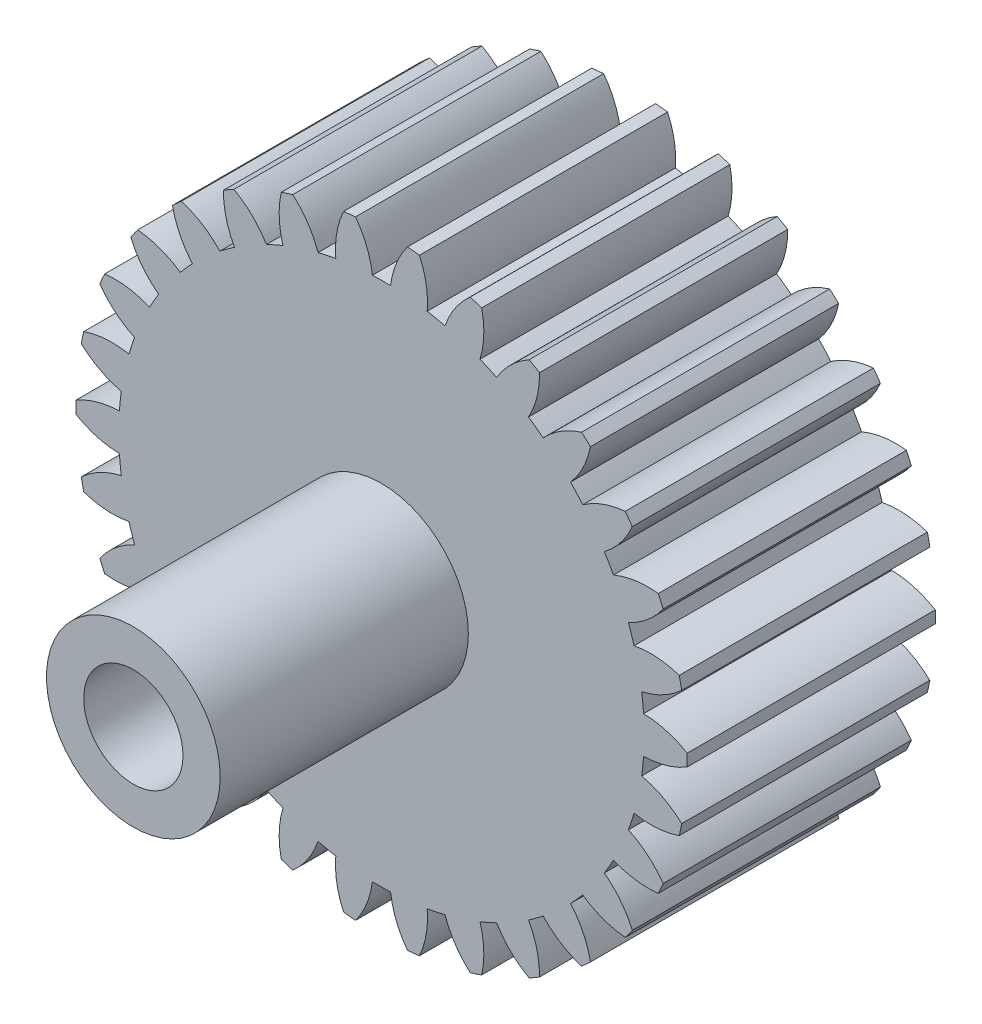
from build123d import *
from build123d.topology import SkipClean

# Parameters (mm, degrees)
SKETCH_1_R               = 12.32
EXTRUDE_1_DEPTH          = 5
PATTERN_CIRCULAR_1_COUNT = 30
SKETCH_6_R               = 3.5
EXTRUDE_2_DEPTH          = 10
SKETCH_7_R               = 2
CUT_EXTRUDE_1_DEPTH      = 3
CUT_EXTRUDE_2_DEPTH      = 25.320150441
CUT_EXTRUDE_2_DEPTH_BACK = 7


with BuildPart() as part:
    # Эскиз1 → Бобышка-Вытянуть1 (new, symmetric)
    with BuildSketch(Plane.XY):
        Circle(SKETCH_1_R)
    extrude(amount=EXTRUDE_1_DEPTH, both=True)

    # Эскиз5 for Вырез-По сечениям1 → Вырез-По сечениям1 section 0
    with BuildSketch(Plane.XY.offset(-5)):
        with BuildLine():
            # circular arc as an exact rational Bezier (weights 1, cos(half-angle), 1)
            Bezier((-1.458691761, 12.736742847), (-0.522105639, 11.856767026), (-0.365824723, 10.581178031), weights=[1, 0.940287899, 1])
            Bezier((-0.365824723, 10.581178031), (0, 10.593825746), (0.365824723, 10.581178031), weights=[1, 0.999402884, 1])
            Bezier((0.365824723, 10.581178031), (0.522105639, 11.856767026), (1.458691761, 12.736742847), weights=[1, 0.940287899, 1])
            Bezier((1.458691761, 12.736742847), (0, 12.903801386), (-1.458691761, 12.736742847), weights=[1, 0.993505682, 1])
        make_face()
    # Эскиз2 for Вырез-По сечениям1 → Вырез-По сечениям1 section 1
    with BuildSketch(Plane.XY.offset(5)):
        with BuildLine():
            Bezier((-1.458691761, 12.736742847), (-0.522105639, 11.856767026), (-0.365824723, 10.581178031), weights=[1, 0.940287899, 1])
            Bezier((-0.365824723, 10.581178031), (0, 10.593825746), (0.365824723, 10.581178031), weights=[1, 0.999402884, 1])
            Bezier((0.365824723, 10.581178031), (0.522105639, 11.856767026), (1.458691761, 12.736742847), weights=[1, 0.940287899, 1])
            Bezier((1.458691761, 12.736742847), (0, 12.903801386), (-1.458691761, 12.736742847), weights=[1, 0.993505682, 1])
        make_face()
    loft_1 = loft(mode=Mode.SUBTRACT)

    # Круговой массив1: Вырез-По сечениям1 ×30 about axis
    pattern_circular_1_axis = Axis((0, 0, 0), (0, 0, 1))
    for i in range(1, PATTERN_CIRCULAR_1_COUNT):
        add(loft_1.rotate(pattern_circular_1_axis, i * 360 / PATTERN_CIRCULAR_1_COUNT), mode=Mode.SUBTRACT)

    # Эскиз6 → Бобышка-Вытянуть2 (add)
    with BuildSketch(Plane.XY.offset(5)):
        Circle(SKETCH_6_R)
    extrude(amount=EXTRUDE_2_DEPTH)

    # Эскиз7 → Вырез-Вытянуть1 (cut)
    with BuildSketch(Plane.XY.offset(15)):
        Circle(SKETCH_7_R)
    extrude(amount=-CUT_EXTRUDE_1_DEPTH, mode=Mode.SUBTRACT)

    # Эскиз8 → Вырез-Вытянуть2 (cut, two sides: drawn at the far end of the back side and taken through both)
    with SkipClean():  # the faces are left unmerged after this step: merging them gives an invalid solid
        with BuildSketch(Plane.XY.offset(12).offset(-CUT_EXTRUDE_2_DEPTH_BACK)):
            with BuildLine():
                Line((1.263922466, 1.55), (-1.263922466, 1.55))
                ThreePointArc((-1.263922466, 1.55), (-0.85794961, -1.806632908), (2, 0))
                ThreePointArc((2, 0), (1.806632908, 0.85794961), (1.263922466, 1.55))
            make_face()
        extrude(amount=CUT_EXTRUDE_2_DEPTH + CUT_EXTRUDE_2_DEPTH_BACK, mode=Mode.SUBTRACT)


solid = part.part
